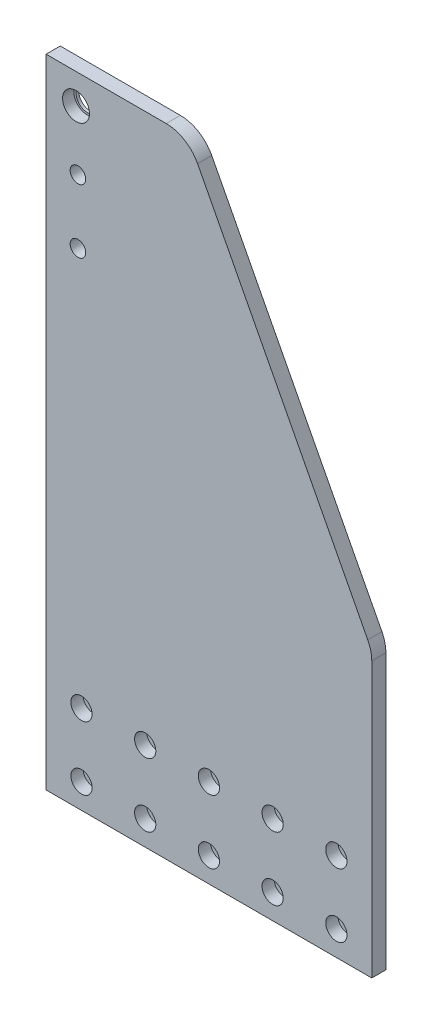
from build123d import *

# Parameters (mm, degrees)
BOSS_EXTRUDE1_DEPTH                                 = 5
CBORE_FOR_M8_HEX_SOCKET_HEAD_CAP_SCREW1_D           = 9
CBORE_FOR_M8_HEX_SOCKET_HEAD_CAP_SCREW1_CBORE_D     = 15
CBORE_FOR_M8_HEX_SOCKET_HEAD_CAP_SCREW1_CBORE_DEPTH = 8.6
SKETCH5_R                                           = 9.5
CUT_EXTRUDE2_DEPTH                                  = 8
SKETCH6_R                                           = 8
CUT_EXTRUDE3_DEPTH                                  = 465.530946224
FILLET1_R                                           = 25
M10_CLEARANCE_HOLE1_D                               = 11
M10_CLEARANCE_HOLE1_DEPTH                           = 25
M10_CLEARANCE_HOLE1_TIP                             = 3.304733405


with BuildPart() as part:
    # Sketch1 → Boss-Extrude1 (new, symmetric)
    with BuildSketch(Plane.XY):
        Polygon((-115, 450), (-115, 0), (115, 0), (115, 200), (-15, 450), align=None)
    extrude(amount=BOSS_EXTRUDE1_DEPTH, both=True)

    # CBORE for M8 Hex Socket Head Cap Screw1 (through all)
    with Locations(Plane.XY.offset(5)):
        with Locations((-90, 17.5), (-45, 17.5), (45, 17.5), (90, 17.5), (0, 17.5), (-90, 62.5), (-45, 62.5), (45, 62.5), (90, 62.5), (0, 62.5)):
            CounterBoreHole(CBORE_FOR_M8_HEX_SOCKET_HEAD_CAP_SCREW1_D / 2, CBORE_FOR_M8_HEX_SOCKET_HEAD_CAP_SCREW1_CBORE_D / 2, CBORE_FOR_M8_HEX_SOCKET_HEAD_CAP_SCREW1_CBORE_DEPTH)

    # Sketch5 → Cut-Extrude2 (cut)
    with BuildSketch(Plane.XY.offset(5)):
        with Locations((-93.85, 428.85)):
            Circle(SKETCH5_R)
    extrude(amount=-CUT_EXTRUDE2_DEPTH, mode=Mode.SUBTRACT)

    # Sketch6 → Cut-Extrude3 (cut, through all)
    with BuildSketch(Plane.XY.offset(-3)):
        with Locations((-93.85, 428.85)):
            Circle(SKETCH6_R)
    extrude(amount=-CUT_EXTRUDE3_DEPTH, mode=Mode.SUBTRACT)

    # Fillet1
    fillet1_edges = [part.edges().sort_by_distance(p)[0] for p in [
        (-15, 450, 0),
        (115, 200, 0),
    ]]
    fillet(fillet1_edges, radius=FILLET1_R)

    # M10 Clearance Hole1
    with Locations(Plane.XY.offset(5)):
        with Locations((-92.5, 387.5), (-92.5, 342.5)):
            Hole(M10_CLEARANCE_HOLE1_D / 2, depth=M10_CLEARANCE_HOLE1_DEPTH)
            with Locations((0, 0, -(M10_CLEARANCE_HOLE1_DEPTH + M10_CLEARANCE_HOLE1_TIP / 2))):  # 118° drill point
                Cone(0, M10_CLEARANCE_HOLE1_D / 2, M10_CLEARANCE_HOLE1_TIP, mode=Mode.SUBTRACT)


solid = part.part
